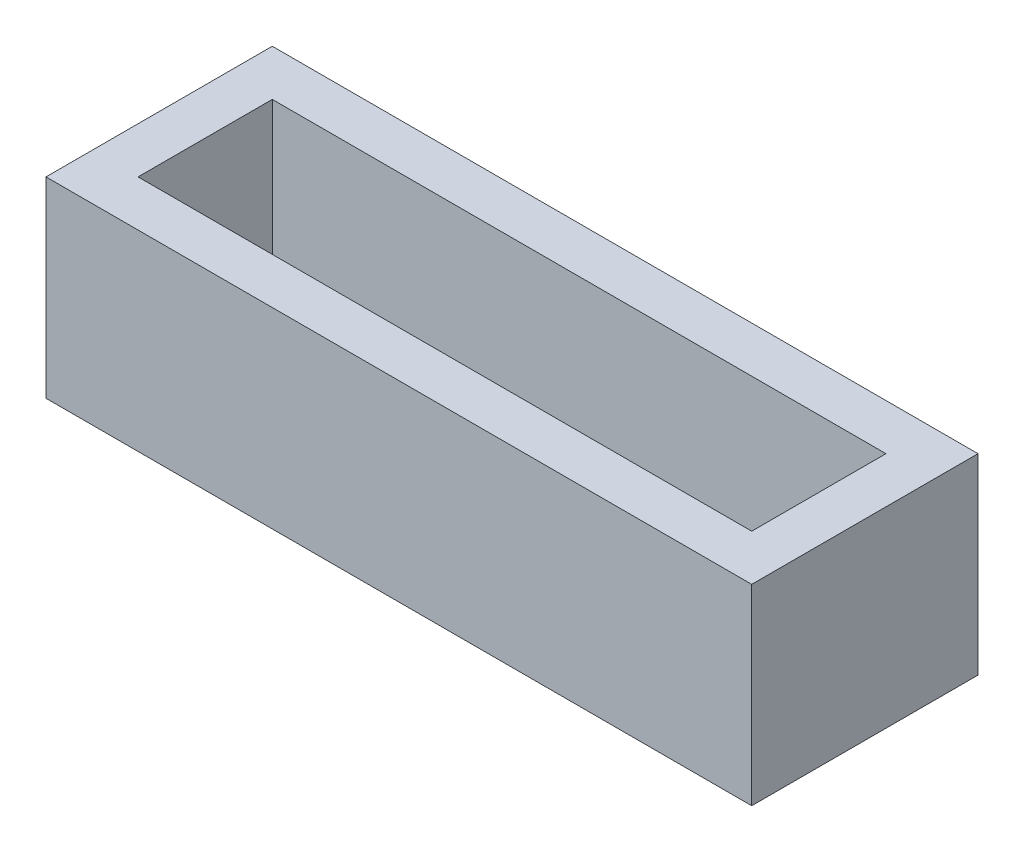
from build123d import *

# Parameters (mm, degrees)
SKETCH1_W           = 18.4
SKETCH1_H           = 5.9
SKETCH1_W_2         = 16
SKETCH1_H_2         = 3.5
BOSS_EXTRUDE1_DEPTH = 5


with BuildPart() as part:
    # Sketch1 → Boss-Extrude1 (new body)
    with BuildSketch(Plane(origin=(0, 0, 0), x_dir=(1, 0, 0), z_dir=(0, 1, 0))):
        Rectangle(SKETCH1_W, SKETCH1_H)
        Rectangle(SKETCH1_W_2, SKETCH1_H_2, mode=Mode.SUBTRACT)
    extrude(amount=BOSS_EXTRUDE1_DEPTH)


solid = part.part
